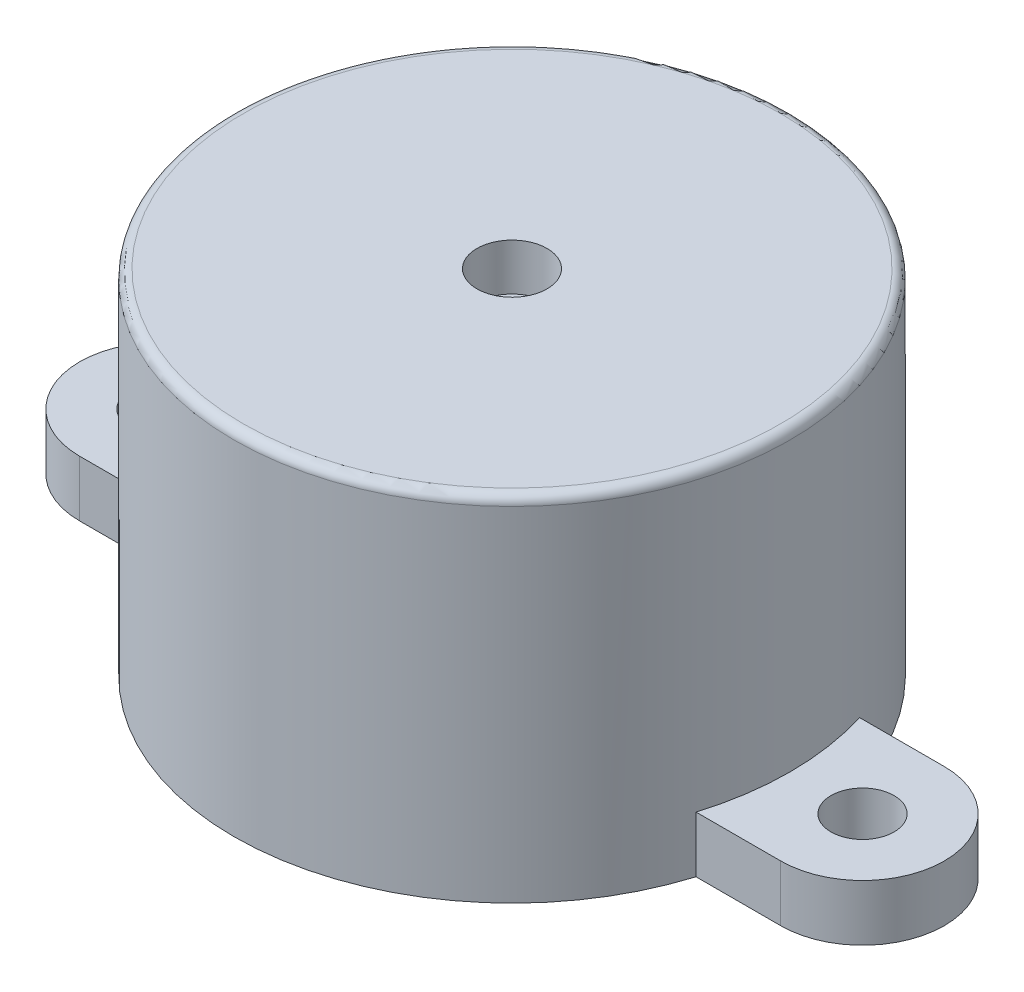
from build123d import *

# Parameters (mm, degrees)
SKETCH3_R           = 1.7145
BOSS_EXTRUDE1_DEPTH = 3.048
FILLET2_R           = 0.508


with BuildPart() as part:
    # Sketch2 → Revolve1 (revolve)
    with BuildSketch(Plane.XY, mode=Mode.PRIVATE) as revolve1_sk:
        Polygon((0, 0), (15.113, 0), (15.113, 19.177), (1.905, 19.177), (1.905, 16.637), (0, 16.637), align=None)
    revolve(revolve1_sk.sketch.rotate(Axis((0, 0, 0), (0, 1, 0)), 90), axis=Axis((0, 0, 0), (0, 1, 0)))

    # Sketch3 → Boss-Extrude1 (add)
    with BuildSketch(Plane.XZ):
        with BuildLine():
            Line((-19.05, 4.445), (19.05, 4.445))
            ThreePointArc((19.05, 4.445), (23.495, 0), (19.05, -4.445))
            Line((19.05, -4.445), (-19.05, -4.445))
            ThreePointArc((-19.05, -4.445), (-23.495, 0), (-19.05, 4.445))
        make_face()
        with Locations(Location((19.05, 0, 0), (0, 0, 270))):
            Circle(SKETCH3_R, mode=Mode.SUBTRACT)
        with Locations(Location((-19.05, 0, 0), (0, 0, 270))):
            Circle(SKETCH3_R, mode=Mode.SUBTRACT)
    extrude(amount=-BOSS_EXTRUDE1_DEPTH)

    # Fillet2
    fillet2_edges = [part.edges().sort_by_distance(p)[0] for p in [
        (0, 19.177, 15.113),
    ]]
    fillet(fillet2_edges, radius=FILLET2_R)


solid = part.part
